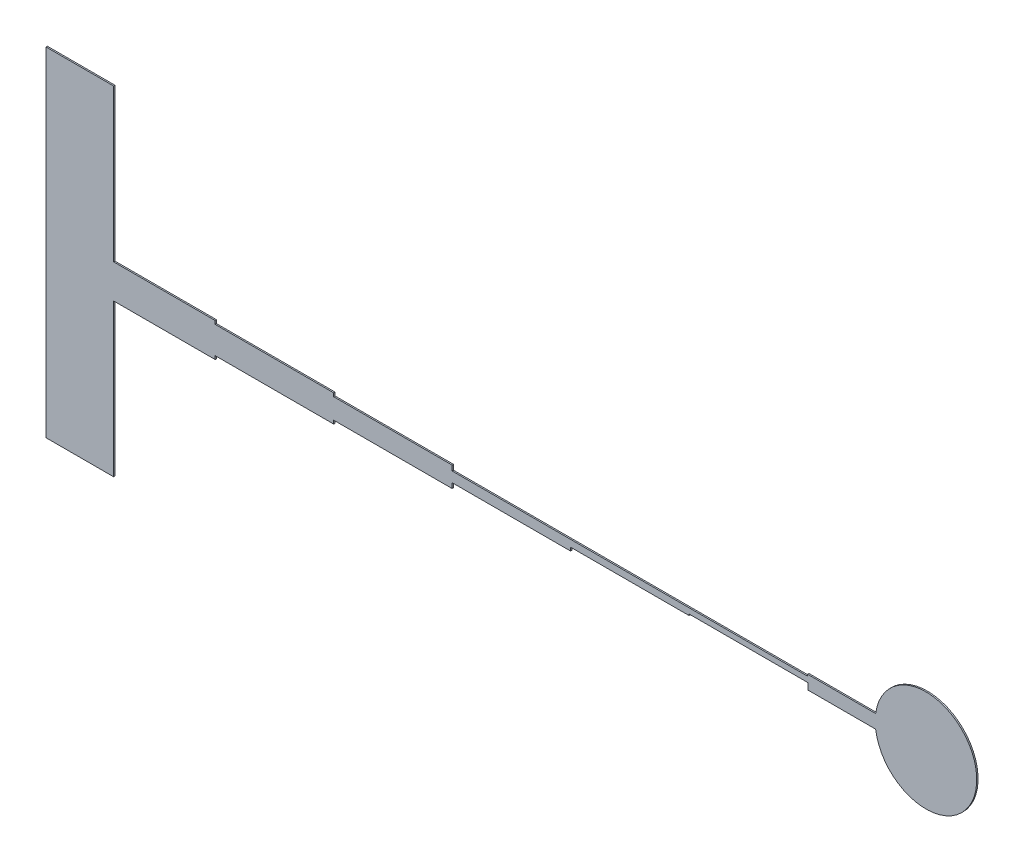
from build123d import *

# Parameters (mm, degrees)
BOSS_EXTRUDE1_DEPTH = 20
SKETCH2_W           = 1000
SKETCH2_H           = 2250
CUT_EXTRUDE1_DEPTH  = 12993.801853334
CUT_EXTRUDE4_DEPTH  = 12993.801853334
SKETCH4_W           = 1750
SKETCH4_H           = 50
CUT_EXTRUDE5_DEPTH  = 12993.801853334
SKETCH5_W           = 1750
SKETCH5_H           = 50
CUT_EXTRUDE6_DEPTH  = 12993.801853334
SKETCH8_W           = 1750
SKETCH8_H           = 100
CUT_EXTRUDE7_DEPTH  = 12993.801853334
SKETCH6_W           = 1750
SKETCH6_H           = 50
CUT_EXTRUDE8_DEPTH  = 12993.801853334
SKETCH9_W           = 1759.91281427
SKETCH9_H           = 120
CUT_EXTRUDE9_DEPTH  = 12993.801853334


with BuildPart() as part:
    # Sketch1 → Boss-Extrude1 (new body)
    with BuildSketch(Plane.XY):
        with BuildLine():
            Line((1000, 250), (5000, 250))
            Line((5000, 250), (5000, 125))
            Line((5000, 125), (9000, 125))
            Line((9000, 125), (9000, 100))
            Line((9000, 100), (11256.696562634, 100))
            ThreePointArc((11256.696562634, 100), (12750, 0), (11256.696562634, -100))
            Line((11256.696562634, -100), (9000, -100))
            Line((9000, -100), (9000, -125))
            Line((9000, -125), (5000, -125))
            Line((5000, -125), (5000, -250))
            Line((5000, -250), (1000, -250))
            Line((1000, -250), (1000, -2500))
            Line((1000, -2500), (-1000, -2500))
            Line((-1000, -2500), (-1000, 2500))
            Line((-1000, 2500), (1000, 2500))
            Line((1000, 2500), (1000, 250))
        make_face()
    extrude(amount=-BOSS_EXTRUDE1_DEPTH)

    # Sketch2 → Cut-Extrude1 (cut, through all)
    with BuildSketch(Plane.XY):
        with Locations((500, 1375)):
            Rectangle(SKETCH2_W, SKETCH2_H)
        with Locations((500, -1375)):
            Rectangle(SKETCH2_W, SKETCH2_H)
    extrude(amount=-CUT_EXTRUDE1_DEPTH, mode=Mode.SUBTRACT)

    # Sketch3 → Cut-Extrude4 (cut, through all)
    with BuildSketch(Plane.XY):
        Polygon((1500, -250), (3250, -250), (5000, -250), (5000, -150), (3250, -150), (3250, -200), (1500, -200), align=None)
    cut_extrude4 = extrude(amount=-CUT_EXTRUDE4_DEPTH, mode=Mode.SUBTRACT)

    # Mirror1: Cut-Extrude4 across plane
    add(cut_extrude4.mirror(Plane.ZX), mode=Mode.SUBTRACT)

    # Sketch4 → Cut-Extrude5 (cut, through all)
    with BuildSketch(Plane.XY):
        with Locations((5875, 100)):
            Rectangle(SKETCH4_W, SKETCH4_H)
    cut_extrude5 = extrude(amount=-CUT_EXTRUDE5_DEPTH, mode=Mode.SUBTRACT)

    # Mirror2: Cut-Extrude5 across plane
    add(cut_extrude5.mirror(Plane.ZX), mode=Mode.SUBTRACT)

    # Sketch5 → Cut-Extrude6 (cut, through all)
    with BuildSketch(Plane.XY):
        with Locations((7625, 100)):
            Rectangle(SKETCH5_W, SKETCH5_H)
    extrude(amount=-CUT_EXTRUDE6_DEPTH, mode=Mode.SUBTRACT)

    # Sketch8 → Cut-Extrude7 (cut, through all)
    with BuildSketch(Plane.XY):
        with Locations((7625, -75)):
            Rectangle(SKETCH8_W, SKETCH8_H)
    extrude(amount=-CUT_EXTRUDE7_DEPTH, mode=Mode.SUBTRACT)

    # Sketch6 → Cut-Extrude8 (cut, through all)
    with BuildSketch(Plane.XY):
        with Locations((9375, 100)):
            Rectangle(SKETCH6_W, SKETCH6_H)
    extrude(amount=-CUT_EXTRUDE8_DEPTH, mode=Mode.SUBTRACT)

    # Sketch9 → Cut-Extrude9 (cut, through all)
    with BuildSketch(Plane.XY):
        with Locations((9379.956407135, -65)):
            Rectangle(SKETCH9_W, SKETCH9_H)
    extrude(amount=-CUT_EXTRUDE9_DEPTH, mode=Mode.SUBTRACT)


solid = part.part
